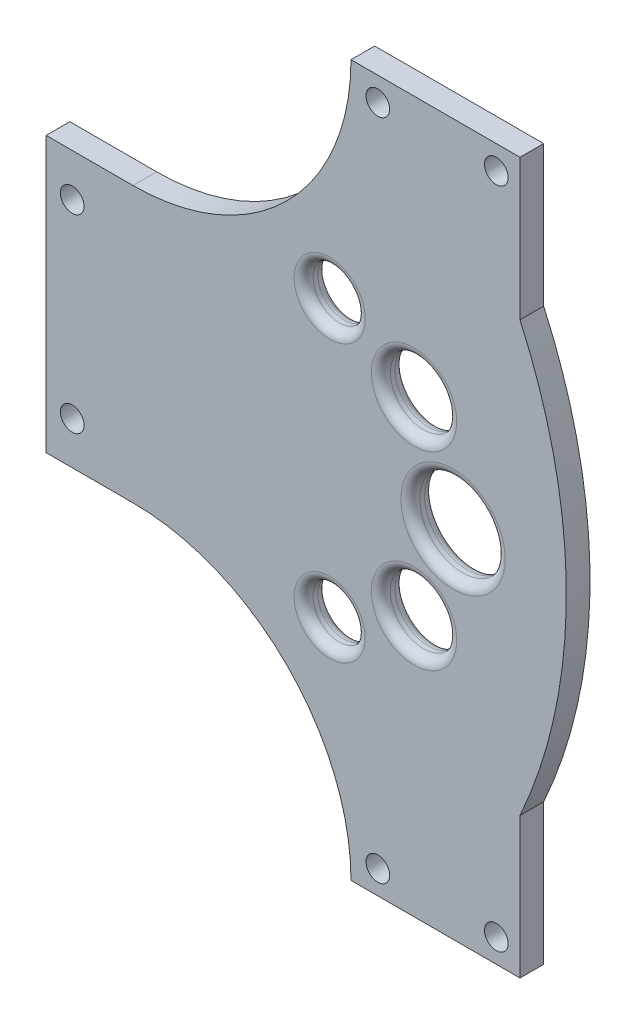
from build123d import *

# Parameters (mm, degrees)
EXTRUDE_2_DEPTH          = 5
CUT_EXTRUDE_6_DEPTH      = 152.30106226
CUT_EXTRUDE_6_DEPTH_BACK = 152.30106226
SKETCH_3_R               = 5.5
SKETCH_3_R_2             = 7
SKETCH_3_R_3             = 9
FILLET_1_R               = 2
SKETCH_4_R               = 2.5
CUT_EXTRUDE_7_DEPTH      = 10
SKETCH_5_R               = 2.5
CUT_EXTRUDE_8_DEPTH      = 10


with BuildPart() as part:
    # Эскиз1 → Бобышка-Вытянуть2 (new body)
    with BuildSketch(Plane.XY):
        with BuildLine():
            Line((0, 0), (0, 58))
            Line((0, 58), (18.334458457, 58))
            ThreePointArc((18.334458457, 58), (50.861370392, 71.473088065), (64.334458457, 104))
            Line((64.334458457, 104), (100, 104))
            Line((100, 104), (100, 74.288093812))
            ThreePointArc((100, 74.288093812), (109.777098892, 29), (100, -16.288093812))
            Line((100, -16.288093812), (100, -46))
            Line((100, -46), (64.334458457, -46))
            ThreePointArc((64.334458457, -46), (50.861370392, -13.473088065), (18.334458457, 0))
            Line((18.334458457, 0), (0, 0))
        make_face()
    extrude(amount=EXTRUDE_2_DEPTH)

    # Эскиз3 → Вырез-Вытянуть6 (cut, two sides: drawn at the far end of the back side and taken through both)
    with BuildSketch(Plane.XY.offset(-CUT_EXTRUDE_6_DEPTH_BACK)):
        with Locations((59.840097389, 58.167904281)):
            Circle(SKETCH_3_R)
        with Locations((77.641016151, 49)):
            Circle(SKETCH_3_R_2)
        with Locations((85.876129499, 29)):
            Circle(SKETCH_3_R_3)
        with Locations(Location((59.840097389, -0.167904281, 0), (0, 0, 180))):
            Circle(SKETCH_3_R)
        with Locations(Location((77.641016151, 9, 0), (0, 0, 180))):
            Circle(SKETCH_3_R_2)
    extrude(amount=CUT_EXTRUDE_6_DEPTH + CUT_EXTRUDE_6_DEPTH_BACK, mode=Mode.SUBTRACT)

    # Скругление1
    fillet_1_edges = [part.edges().sort_by_distance(p)[0] for p in [
        (84.641016151, 9, 0),
        (84.641016151, 9, 5),
        (65.340097389, -0.167904281, 0),
        (65.340097389, -0.167904281, 5),
        (76.876129499, 29, 0),
        (76.876129499, 29, 5),
        (70.641016151, 49, 0),
        (70.641016151, 49, 5),
        (54.340097389, 58.167904281, 0),
        (54.340097389, 58.167904281, 5),
    ]]
    fillet(fillet_1_edges, radius=FILLET_1_R)

    # Эскиз4 → Вырез-Вытянуть7 (cut)
    with BuildSketch(Plane.XY.offset(5)):
        with Locations((5.5, 49)):
            Circle(SKETCH_4_R)
        with Locations((5.5, 9)):
            Circle(SKETCH_4_R)
    extrude(amount=-CUT_EXTRUDE_7_DEPTH, mode=Mode.SUBTRACT)

    # Эскиз5 → Вырез-Вытянуть8 (cut)
    with BuildSketch(Plane.XY.offset(5)):
        with Locations((70, -41)):
            Circle(SKETCH_5_R)
        with Locations((95, -41)):
            Circle(SKETCH_5_R)
        with Locations((70, 99)):
            Circle(SKETCH_5_R)
        with Locations((95, 99)):
            Circle(SKETCH_5_R)
    extrude(amount=-CUT_EXTRUDE_8_DEPTH, mode=Mode.SUBTRACT)


solid = part.part
